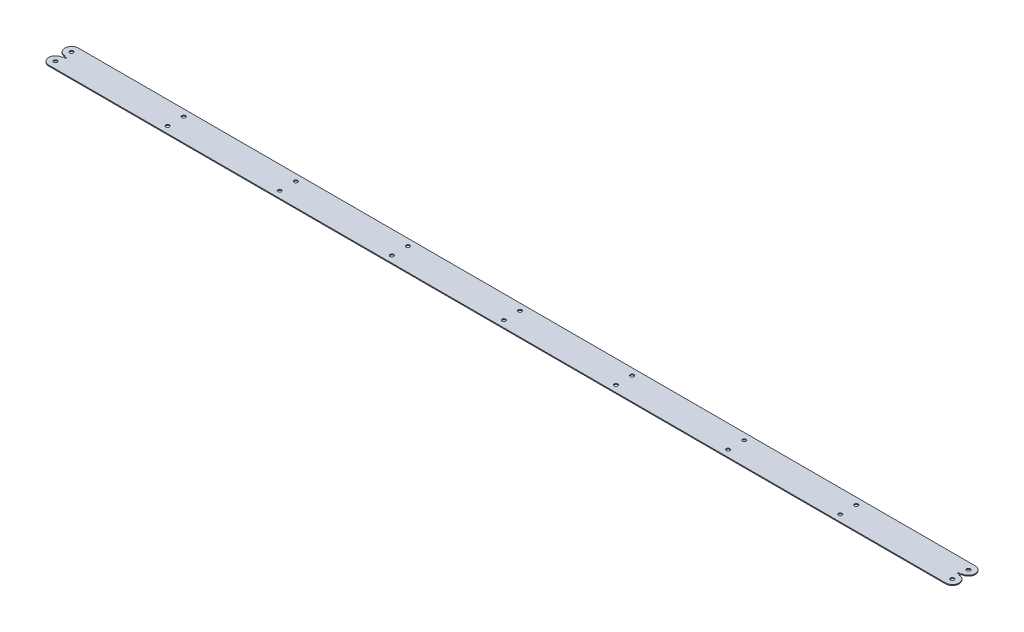
from build123d import *

# Parameters (mm, degrees)
SKETCH1_R           = 2
BOSS_EXTRUDE1_DEPTH = 1


with BuildPart() as part:
    # Sketch1 → Boss-Extrude1 (new body)
    with BuildSketch(Plane(origin=(0, 0, 0), x_dir=(1, 0, 0), z_dir=(0, 1, 0))):
        with BuildLine():
            Line((-500, -7.5), (500, -7.5))
            ThreePointArc((500, -7.5), (507.5, 0), (500, 7.5))
            Line((500, 7.5), (500, 8.5))
            Line((500, 8.5), (497, 8.5))
            Line((497, 8.5), (497, 9.5))
            Line((497, 9.5), (500, 9.5))
            Line((500, 9.5), (500, 10.5))
            ThreePointArc((500, 10.5), (507.5, 18), (500, 25.5))
            Line((500, 25.5), (-500, 25.5))
            ThreePointArc((-500, 25.5), (-507.5, 18), (-500, 10.5))
            Line((-500, 10.5), (-500, 9.5))
            Line((-500, 9.5), (-497, 9.5))
            Line((-497, 9.5), (-497, 8.5))
            Line((-497, 8.5), (-500, 8.5))
            Line((-500, 8.5), (-500, 7.5))
            ThreePointArc((-500, 7.5), (-504.937104415, 5.645794895), (-507.433034374, 1))
            Line((-507.433034374, 1), (-507.5, 1))
            Line((-507.5, 1), (-507.5, -1))
            Line((-507.5, -1), (-507.433034374, -1))
            ThreePointArc((-507.433034374, -1), (-504.937104415, -5.645794895), (-500, -7.5))
        make_face()
        with Locations(Location((0, 0, 0), (0, 0, 270))):
            Circle(SKETCH1_R, mode=Mode.SUBTRACT)
        with Locations(Location((125, 0, 0), (0, 0, 270))):
            Circle(SKETCH1_R, mode=Mode.SUBTRACT)
        with Locations(Location((250, 0, 0), (0, 0, 270))):
            Circle(SKETCH1_R, mode=Mode.SUBTRACT)
        with Locations(Location((375, 0, 0), (0, 0, 270))):
            Circle(SKETCH1_R, mode=Mode.SUBTRACT)
        with Locations(Location((500, 0, 0), (0, 0, 270))):
            Circle(SKETCH1_R, mode=Mode.SUBTRACT)
        with Locations(Location((-125, 0, 0), (0, 0, 270))):
            Circle(SKETCH1_R, mode=Mode.SUBTRACT)
        with Locations(Location((-250, 0, 0), (0, 0, 270))):
            Circle(SKETCH1_R, mode=Mode.SUBTRACT)
        with Locations(Location((-375, 0, 0), (0, 0, 270))):
            Circle(SKETCH1_R, mode=Mode.SUBTRACT)
        with Locations(Location((-500, 0, 0), (0, 0, 270))):
            Circle(SKETCH1_R, mode=Mode.SUBTRACT)
        with Locations(Location((0, 18, 0), (0, 0, 270))):
            Circle(SKETCH1_R, mode=Mode.SUBTRACT)
        with Locations(Location((125, 18, 0), (0, 0, 270))):
            Circle(SKETCH1_R, mode=Mode.SUBTRACT)
        with Locations(Location((250, 18, 0), (0, 0, 270))):
            Circle(SKETCH1_R, mode=Mode.SUBTRACT)
        with Locations(Location((375, 18, 0), (0, 0, 270))):
            Circle(SKETCH1_R, mode=Mode.SUBTRACT)
        with Locations(Location((500, 18, 0), (0, 0, 270))):
            Circle(SKETCH1_R, mode=Mode.SUBTRACT)
        with Locations(Location((-125, 18, 0), (0, 0, 270))):
            Circle(SKETCH1_R, mode=Mode.SUBTRACT)
        with Locations(Location((-250, 18, 0), (0, 0, 270))):
            Circle(SKETCH1_R, mode=Mode.SUBTRACT)
        with Locations(Location((-375, 18, 0), (0, 0, 270))):
            Circle(SKETCH1_R, mode=Mode.SUBTRACT)
        with Locations(Location((-500, 18, 0), (0, 0, 270))):
            Circle(SKETCH1_R, mode=Mode.SUBTRACT)
    extrude(amount=BOSS_EXTRUDE1_DEPTH)


solid = part.part
